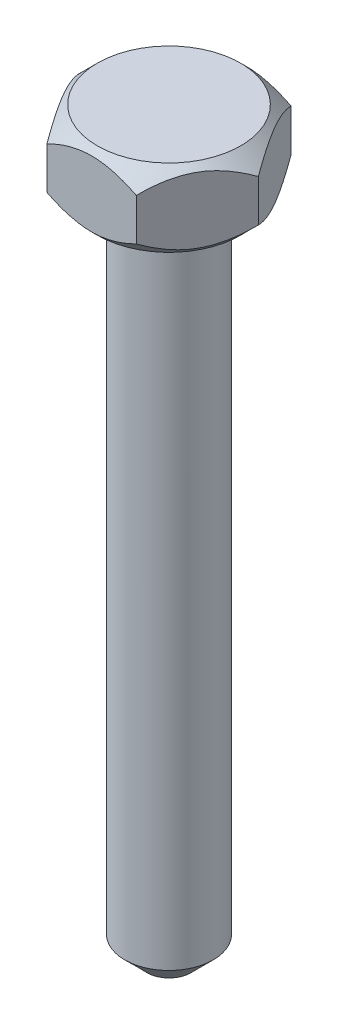
from build123d import *

# Parameters (mm, degrees)
EXTRUDE_1_DEPTH = 3.5
SKETCH_5_R      = 2
EXTRUDE_2_DEPTH = 30
CHAMFER_1_SIZE  = 1


with BuildPart() as part:
    # Эскиз1 → Вытянуть1 (new body)
    with BuildSketch(Plane(origin=(0, 0, 0), x_dir=(1, 0, 0), z_dir=(0, 1, 0))):
        Polygon((-2.020725942, 3.5), (2.020725942, 3.5), (4.041451884, 0), (2.020725942, -3.5), (-2.020725942, -3.5), (-4.041451884, 0), align=None)
    extrude(amount=-EXTRUDE_1_DEPTH)

    # Эскиз5 → Вытянуть2 (add)
    with BuildSketch(Plane.XZ.offset(3.5)):
        with Locations(Location((0, 0, 0), (0, 0, 90))):
            Circle(SKETCH_5_R)
    extrude(amount=EXTRUDE_2_DEPTH)

    # Фаска1
    chamfer_1_edges = [part.edges().sort_by_distance(p)[0] for p in [
        (0, -33.5, -2),
    ]]
    chamfer(chamfer_1_edges, length=CHAMFER_1_SIZE)

    # Эскиз4 → Вырез-Повернуть1 (revolve, cut)
    with BuildSketch(Plane.XY, mode=Mode.PRIVATE) as cut_revolve_1_sk:
        Polygon((-4.041451884, -0.8), (-3.241451884, 0), (-4.041451884, 0), align=None)
        Polygon((-4.041451884, -2.7), (-3.241451884, -3.5), (-4.041451884, -3.5), align=None)
    revolve(cut_revolve_1_sk.sketch.rotate(Axis((0, -3.5, 0), (0, -1, 0)), 120.000000136), axis=Axis((0, -3.5, 0), (0, -1, 0)), mode=Mode.SUBTRACT)


solid = part.part
